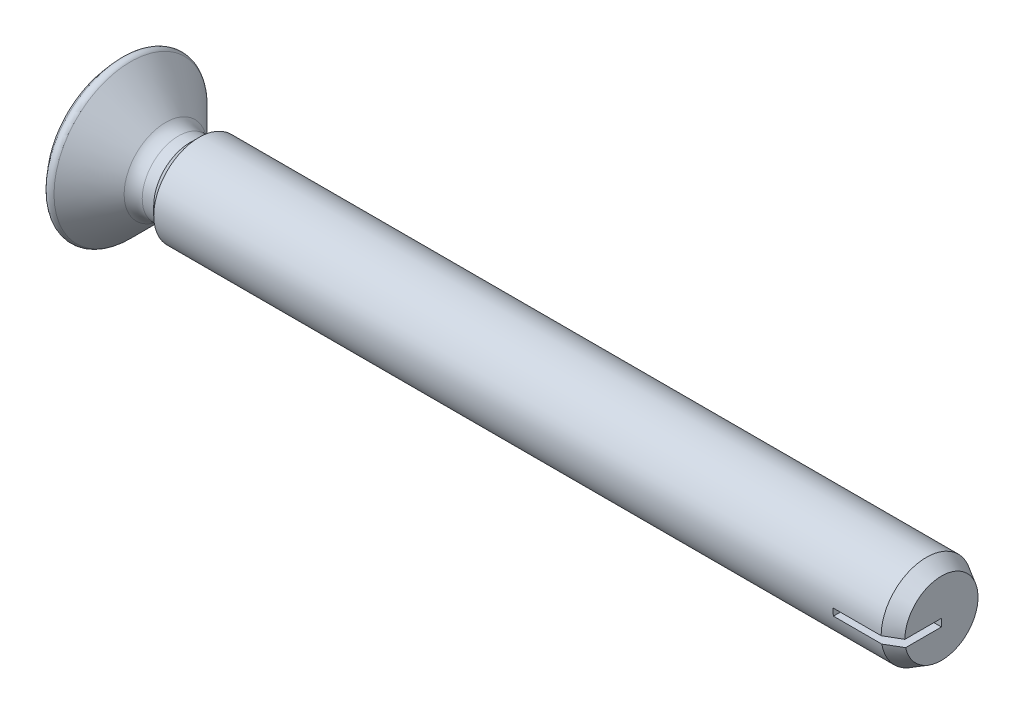
from build123d import *

# Parameters (mm, degrees)
CUT_EXTRUDE3_DEPTH         = 2.5
DRAFT1_ANGLE               = -20
RECESSI_CUT_EXTRUDE5_DEPTH = 2.5
SKETCH11_W                 = 7
SKETCH11_H                 = 0.833333333
POINT_CUT_EXTRUDE8_DEPTH   = 91.82586522


with BuildPart() as part:
    # Sketch1 → base-Revolve (revolve)
    with BuildSketch(Plane.XY, mode=Mode.PRIVATE) as base_revolve_sk:
        with BuildLine():
            Line((0.441941738, 8.458058262), (4.314213562, 4.585786438))
            ThreePointArc((4.314213562, 4.585786438), (4.96306026, 4.152240935), (5.728427125, 4))
            Line((5.728427125, 4), (7, 4))
            Line((7, 4), (8, 5))
            Line((8, 5), (90, 5))
            Line((90, 5), (90, 0))
            Line((90, 0), (0, 0))
            Line((0, 0), (-3.821717386, 0))
            ThreePointArc((-3.821717386, 0), (-2.948605496, 4.546518178), (-0.453487574, 8.446202584))
            ThreePointArc((-0.453487574, 8.446202584), (-0.00827441, 8.641061748), (0.441941738, 8.458058262))
        make_face()
    revolve(base_revolve_sk.sketch.rotate(Axis((0, 0, 0), (1, 0, 0)), 90), axis=Axis((0, 0, 0), (1, 0, 0)))

    # Sketch4 → Cut-Extrude3 (cut)
    with BuildSketch(Plane(origin=(-3.821717386, 0, 0), x_dir=(0, 0, -1), z_dir=(1, 0, 0))):
        Polygon((0.99, 4.94), (-0.99, 4.94), (-0.99, 0.99), (-4.94, 0.99), (-4.94, -0.99), (-0.99, -0.99), (-0.99, -4.94), (0.99, -4.94), (0.99, -0.99), (4.94, -0.99), (4.94, 0.99), (0.99, 0.99), align=None)
    extrude(amount=CUT_EXTRUDE3_DEPTH, mode=Mode.SUBTRACT)

    # Draft1
    draft1_faces = [part.faces().sort_by_distance(p)[0] for p in [
        (-2.045493587, 0, -4.94),
        (-2.045493587, -4.94, 0),
        (-2.045493587, 0, 4.94),
        (-2.045493587, 4.94, 0),
    ]]
    draft(draft1_faces, Plane(origin=(-3.821717386, 0, 0), x_dir=(0, 0, 1), z_dir=(1, 0, 0)), DRAFT1_ANGLE)

    # Sketch5 → recessI_Cut-Extrude5 (cut)
    with BuildSketch(Plane.ZY.offset(3.821717386)):
        Polygon((0.99, 1.978), (1.978, 0.99), (0.99, 0.99), align=None)
        Polygon((-0.99, 0.99), (-1.978, 0.99), (-0.99, 1.978), align=None)
        Polygon((-0.99, -1.978), (-1.978, -0.99), (-0.99, -0.99), align=None)
        Polygon((0.99, -0.99), (1.978, -0.99), (0.99, -1.978), align=None)
    extrude(amount=-RECESSI_CUT_EXTRUDE5_DEPTH, mode=Mode.SUBTRACT)

    # Sketch8 → point_Cut-Revolve1 (revolve, cut)
    with BuildSketch(Plane.XY, mode=Mode.PRIVATE) as point_cut_revolve1_sk:
        Polygon((90, 0), (90.508, 0), (90.508, 5.508), (88.337231225, 5.508), (88.337231225, 5), (90, 4.04), align=None)
    revolve(point_cut_revolve1_sk.sketch.rotate(Axis((0, 0, 0), (1, 0, 0)), 90), axis=Axis((0, 0, 0), (1, 0, 0)), mode=Mode.SUBTRACT)

    # Sketch11 → point_Cut-Extrude8 (cut, through all)
    with BuildSketch(Plane.XY):
        with Locations((86.5, -0.416666667)):
            Rectangle(SKETCH11_W, SKETCH11_H)
    extrude(amount=POINT_CUT_EXTRUDE8_DEPTH, mode=Mode.SUBTRACT)


solid = part.part
